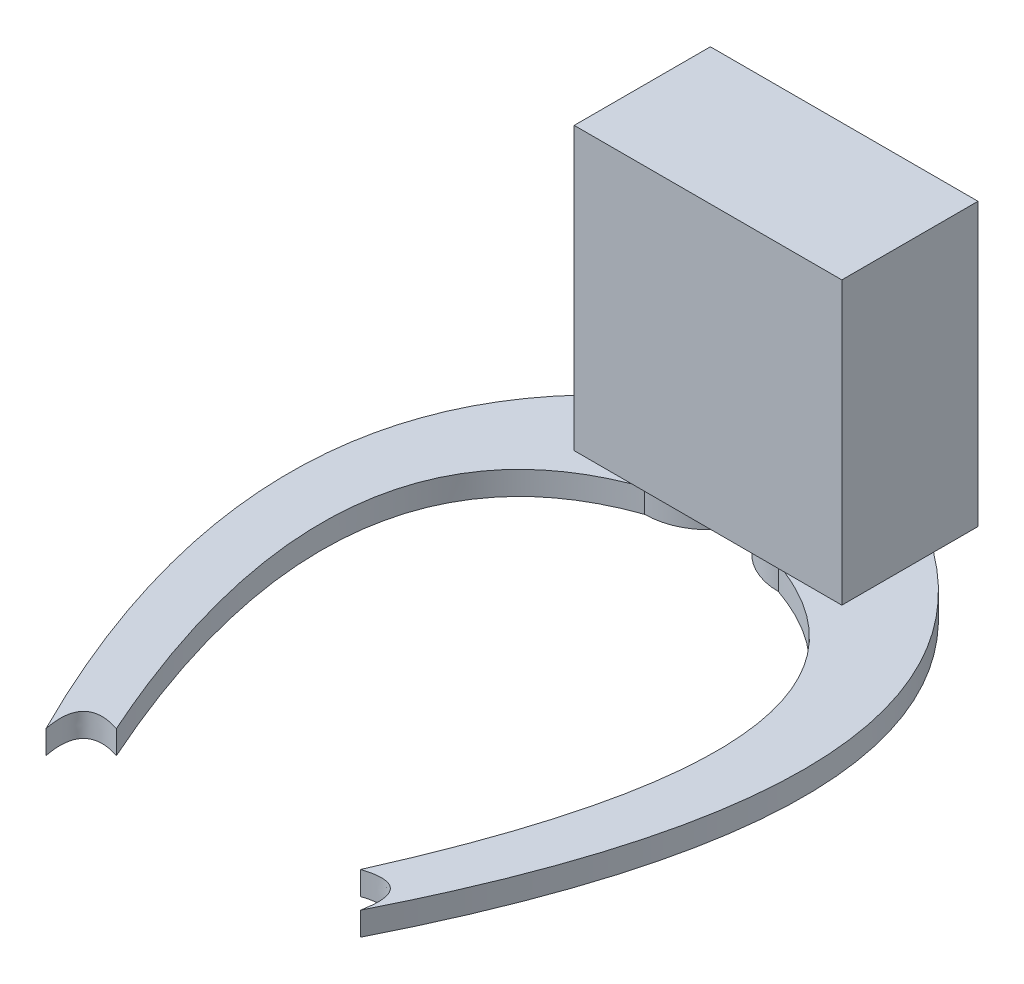
from build123d import *

# Parameters (mm, degrees)
CROQUIS1_W              = 22.8
CROQUIS1_H              = 24
SALIENTE_EXTRUIR2_DEPTH = 11.6
CROQUIS2_R              = 2.5
SALIENTE_EXTRUIR3_DEPTH = 2


with BuildPart() as part:
    # Croquis1 → Saliente-Extruir2 (new body)
    with BuildSketch(Plane.XY):
        with Locations((0, 12)):
            Rectangle(CROQUIS1_W, CROQUIS1_H)
    extrude(amount=SALIENTE_EXTRUIR2_DEPTH)

    # Croquis2 → Saliente-Extruir3 (add)
    # profile 1 of 2: a face of its own
    with BuildSketch(Plane.XZ):
        with BuildLine():
            ThreePointArc((-5.7, 11.3), (-0.2, 5.8), (-5.7, 0.3))
            add(Edge.make_bspline(
                [(-13.4, 54.6), (-33.650343632, 14.235003165), (-5.7, 0.3)],
                knots=[0, 0, 0, 1, 1, 1], degree=2))
            add(Edge.make_bspline(
                [(-10.4, 51.6), (-14.231568326, 50.359614524), (-13.4, 54.6)],
                knots=[0, 0, 0, 1, 1, 1], degree=2))
            add(Edge.make_bspline(
                [(-5.7, 11.3), (-25.29034591, 18.195219879), (-10.4, 51.6)],
                knots=[0, 0, 0, 1, 1, 1], degree=2))
        make_face()
        with Locations(Location((-5.7, 5.8, 0), (0, 0, 270))):
            Circle(CROQUIS2_R, mode=Mode.SUBTRACT)
    # profile 2 of 2: a face of its own
    with BuildSketch(Plane.XZ):
        with BuildLine():
            ThreePointArc((5.7, 11.3), (0.2, 5.8), (5.7, 0.3))
            add(Edge.make_bspline(
                [(13.4, 54.6), (33.650343632, 14.235003165), (5.7, 0.3)],
                knots=[0, 0, 0, 1, 1, 1], degree=2))
            add(Edge.make_bspline(
                [(10.4, 51.6), (14.231568326, 50.359614524), (13.4, 54.6)],
                knots=[0, 0, 0, 1, 1, 1], degree=2))
            add(Edge.make_bspline(
                [(5.7, 11.3), (25.29034591, 18.195219879), (10.4, 51.6)],
                knots=[0, 0, 0, 1, 1, 1], degree=2))
        make_face()
        with Locations(Location((5.7, 5.8, 0), (0, 0, 90))):
            Circle(CROQUIS2_R, mode=Mode.SUBTRACT)
    extrude(amount=SALIENTE_EXTRUIR3_DEPTH)


solid = part.part
